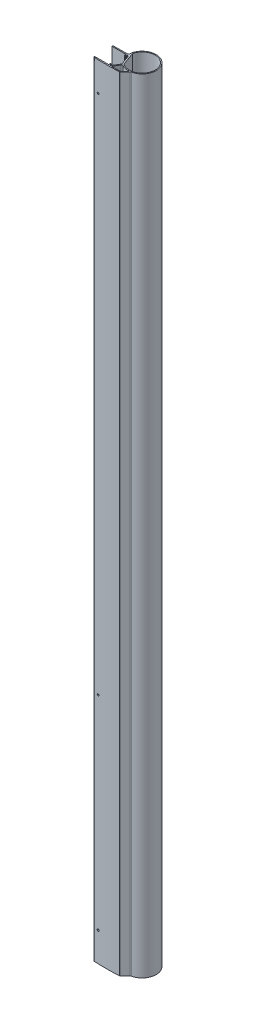
from build123d import *

# Parameters (mm, degrees)
BOSS_EXTRUDE1_DEPTH     = 1008.5
CUT_EXTRUDE8_REACH      = 1013.713
SKETCH11_R              = 4.5
CUT_EXTRUDE9_DEPTH      = 1013.437328334
CUT_EXTRUDE9_DEPTH_BACK = 1013.437328334
SKETCH12_R              = 2.5


with BuildPart() as part:
    # Sketch1 → Boss-Extrude1 (new, symmetric)
    with BuildSketch(Plane(origin=(0, 0, 0), x_dir=(1, 0, 0), z_dir=(0, 1, 0))):
        with BuildLine():
            Line((-37.94716961, 0.506820454), (-73.000143881, 0))
            ThreePointArc((-73.000143881, 0), (-74.414357444, -0.585786438), (-75.000143881, -2))
            Line((-75.000143881, -2), (-75.000143881, -2.5))
            Line((-75.000143881, -2.5), (-39.997487016, -2.5))
            ThreePointArc((-39.997487016, -2.5), (-39.290380235, -2.792893219), (-38.997487016, -3.5))
            Line((-38.997487016, -3.5), (-38.997485501, -6.3))
            ThreePointArc((-38.997485501, -6.3), (-38.938906858, -6.441421356), (-38.797485501, -6.5))
            Line((-38.797485501, -6.5), (-36.697485501, -6.5))
            ThreePointArc((-36.697485501, -6.5), (-36.556064145, -6.441421356), (-36.497485501, -6.3))
            Line((-36.497485501, -6.3), (-36.497487016, -3.5))
            ThreePointArc((-36.497487016, -3.5), (-36.204593797, -2.792893219), (-35.497487016, -2.5))
            Line((-35.497487016, -2.5), (-35.412648282, -2.5))
            Line((-35.412648282, -2.5), (-34.362345798, -2.499996562))
            ThreePointArc((-34.362345798, -2.499996562), (-32.928400236, -2.952114279), (-32.013106674, -4.144946203))
            Line((-32.013106674, -4.144946203), (-29.939265541, -9.842777887))
            ThreePointArc((-29.939265541, -9.842777887), (-29.898753005, -9.909524064), (-29.835771579, -9.955672276))
            Line((-29.835771579, -9.955672276), (-28.928105661, -10.378441827))
            ThreePointArc((-28.928105661, -10.378441827), (-28.824631682, -10.491281335), (-28.831276178, -10.644237112))
            Line((-28.831276178, -10.644237112), (-29.254653402, -11.552522879))
            ThreePointArc((-29.254653402, -11.552522879), (-29.273189645, -11.628310631), (-29.261317881, -11.705423775))
            Line((-29.261317881, -11.705423775), (-25.509217686, -22.014234336))
            ThreePointArc((-25.509217686, -22.014234336), (-25.46870515, -22.080980513), (-25.405723723, -22.127128725))
            Line((-25.405723723, -22.127128725), (-24.501384276, -22.548348884))
            ThreePointArc((-24.501384276, -22.548348884), (-24.397910297, -22.661188393), (-24.404554793, -22.814144169))
            Line((-24.404554793, -22.814144169), (-24.82638076, -23.71910197))
            ThreePointArc((-24.82638076, -23.71910197), (-24.844917003, -23.794889723), (-24.833045239, -23.872002866))
            Line((-24.833045239, -23.872002866), (-23.379997202, -27.864219537))
            ThreePointArc((-23.379997202, -27.864219537), (-23.21184612, -29.166799833), (-23.616244005, -30.416380789))
            Line((-23.616244005, -30.416380789), (-32.98460421, -46.271749821))
            ThreePointArc((-32.98460421, -46.271749821), (-33.897883205, -47.171330572), (-35.136955853, -47.499999136))
            Line((-35.136955853, -47.499999136), (-35.422290221, -47.5))
            Line((-35.422290221, -47.5), (-35.497487016, -47.5))
            ThreePointArc((-35.497487016, -47.5), (-36.204593797, -47.207106781), (-36.497487016, -46.5))
            Line((-36.497487016, -46.5), (-36.497487016, -42.7))
            ThreePointArc((-36.497487016, -42.7), (-36.55606566, -42.558578644), (-36.697487016, -42.5))
            Line((-36.697487016, -42.5), (-38.797487016, -42.5))
            ThreePointArc((-38.797487016, -42.5), (-38.938908372, -42.558578644), (-38.997487016, -42.7))
            Line((-38.997487016, -42.7), (-38.997487016, -46.5))
            ThreePointArc((-38.997487016, -46.5), (-39.290380235, -47.207106781), (-39.997487016, -47.5))
            Line((-39.997487016, -47.5), (-75.000143881, -47.5))
            Line((-75.000143881, -47.5), (-75.000143881, -47.992016221))
            ThreePointArc((-75.000143881, -47.992016221), (-74.476179186, -49.341579032), (-73.178824101, -49.984018575))
            ThreePointArc((-73.178824101, -49.984018575), (-40.99410945, -50.77377865), (-8.813286974, -49.838769061))
            ThreePointArc((-8.813286974, -49.838769061), (-7.817825729, -49.566662453), (-6.973469828, -48.973325947))
            Line((-6.973469828, -48.973325947), (5.556165629, -36.44369049))
            ThreePointArc((5.556165629, -36.44369049), (6.674830247, -35.602154275), (7.982938142, -35.103709226))
            ThreePointArc((7.982938142, -35.103709226), (25.648495666, 25.261577333), (-34.978413962, 8.515904073))
            ThreePointArc((-34.978413962, 8.515904073), (-35.260781732, 6.320433496), (-35.053238097, 4.116630362))
            ThreePointArc((-35.053238097, 4.116630362), (-35.649860244, 1.630017442), (-37.94716961, 0.506820454))
        make_face()
        with BuildLine():
            Line((-32.498699617, 7.422524845), (-20.124374909, -26.575652871))
            ThreePointArc((-20.124374909, -26.575652871), (-19.98425081, -26.834207602), (-19.774975778, -27.040821427))
            ThreePointArc((-19.774975778, -27.040821427), (31.479558915, 11.457674801), (-32.530048939, 8.003454065))
            ThreePointArc((-32.530048939, 8.003454065), (-32.557554107, 7.710659294), (-32.498699617, 7.422524845))
        make_face(mode=Mode.SUBTRACT)
        with BuildLine():
            Line((-7.854761509, -47.026168146), (1.472266864, -37.699196277))
            ThreePointArc((1.472266864, -37.699196277), (1.685035787, -36.599872322), (0.744482165, -35.992301209))
            ThreePointArc((0.744482165, -35.992301209), (-8.846559118, -34.896108548), (-17.801482894, -31.290688819))
            ThreePointArc((-17.801482894, -31.290688819), (-20.059404021, -30.999935476), (-21.871341724, -32.378205072))
            Line((-21.871341724, -32.378205072), (-30.245907528, -46.627814773))
            ThreePointArc((-30.245907528, -46.627814773), (-30.246285121, -47.640532503), (-29.362073143, -48.134259674))
            ThreePointArc((-29.362073143, -48.134259674), (-18.930131996, -47.81679853), (-8.505313649, -47.317458849))
            ThreePointArc((-8.505313649, -47.317458849), (-8.153202932, -47.231744478), (-7.854761509, -47.026168146))
        make_face(mode=Mode.SUBTRACT)
    extrude(amount=BOSS_EXTRUDE1_DEPTH, both=True)

    # Sketch11 → Cut-Extrude8 (cut, up to next)
    with BuildSketch(Plane(origin=(-29.600444605, 0, 10.773680757), x_dir=(0.3420201433247534, 0, 0.9396926207862416), z_dir=(-0.9396926207862416, 0, 0.3420201433247534)), mode=Mode.PRIVATE) as cut_extrude8_sk1:
        with Locations(Location((0, -963.5, 0), (0, 0, 77.270863135))):
            Circle(SKETCH11_R)
    cut_extrude8_tool1 = extrude(cut_extrude8_sk1.sketch, amount=-CUT_EXTRUDE8_REACH, mode=Mode.PRIVATE) & part.part
    # Sketch11 → Cut-Extrude8 (cut, up to next)
    with BuildSketch(Plane(origin=(-29.600444605, 0, 10.773680757), x_dir=(0.3420201433247534, 0, 0.9396926207862416), z_dir=(-0.9396926207862416, 0, 0.3420201433247534)), mode=Mode.PRIVATE) as cut_extrude8_sk2:
        with Locations(Location((0, -864.5, 0), (0, 0, 282.729136865))):
            Circle(SKETCH11_R)
    cut_extrude8_tool2 = extrude(cut_extrude8_sk2.sketch, amount=-CUT_EXTRUDE8_REACH, mode=Mode.PRIVATE) & part.part
    # Sketch11 → Cut-Extrude8 (cut, up to next)
    with BuildSketch(Plane(origin=(-29.600444605, 0, 10.773680757), x_dir=(0.3420201433247534, 0, 0.9396926207862416), z_dir=(-0.9396926207862416, 0, 0.3420201433247534)), mode=Mode.PRIVATE) as cut_extrude8_sk3:
        with Locations(Location((0, 963.5, 0), (0, 0, 77.270863135))):
            Circle(SKETCH11_R)
    cut_extrude8_tool3 = extrude(cut_extrude8_sk3.sketch, amount=-CUT_EXTRUDE8_REACH, mode=Mode.PRIVATE) & part.part
    # Sketch11 → Cut-Extrude8 (cut, up to next)
    with BuildSketch(Plane(origin=(-29.600444605, 0, 10.773680757), x_dir=(0.3420201433247534, 0, 0.9396926207862416), z_dir=(-0.9396926207862416, 0, 0.3420201433247534)), mode=Mode.PRIVATE) as cut_extrude8_sk4:
        with Locations(Location((0, 864.5, 0), (0, 0, 77.270863135))):
            Circle(SKETCH11_R)
    cut_extrude8_tool4 = extrude(cut_extrude8_sk4.sketch, amount=-CUT_EXTRUDE8_REACH, mode=Mode.PRIVATE) & part.part
    add(cut_extrude8_tool1.solids().sort_by_distance((-29.600445, -963.5, 10.773681))[0], mode=Mode.SUBTRACT)
    add(cut_extrude8_tool2.solids().sort_by_distance((-29.600445, -864.5, 10.773681))[0], mode=Mode.SUBTRACT)
    add(cut_extrude8_tool3.solids().sort_by_distance((-29.600445, 963.5, 10.773681))[0], mode=Mode.SUBTRACT)
    add(cut_extrude8_tool4.solids().sort_by_distance((-29.600445, 864.5, 10.773681))[0], mode=Mode.SUBTRACT)

    # Sketch12 → Cut-Extrude9 (cut, two sides: drawn at the far end of the back side and taken through both)
    with BuildSketch(Plane(origin=(0.010443156, 0, 2.5), x_dir=(-1, 0, 0), z_dir=(0, 0, -1)).offset(-CUT_EXTRUDE9_DEPTH_BACK)):
        with Locations((63.010587037, -933.5)):
            Circle(SKETCH12_R)
        with Locations((63.010587037, -408.5)):
            Circle(SKETCH12_R)
        with Locations((63.010587037, 933.5)):
            Circle(SKETCH12_R)
    extrude(amount=CUT_EXTRUDE9_DEPTH + CUT_EXTRUDE9_DEPTH_BACK, mode=Mode.SUBTRACT)


solid = part.part
